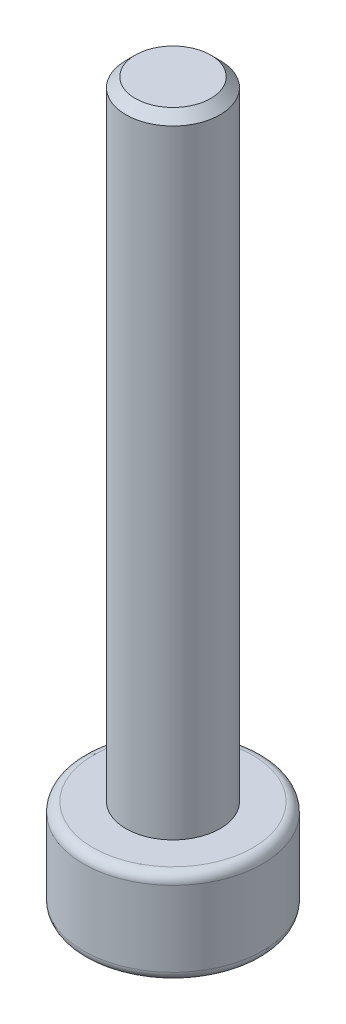
from build123d import *

# Parameters (mm, degrees)
SKETCH_1_R          = 2.85
EXTRUDE_1_DEPTH     = 3
SKETCH_2_R          = 1.5
EXTRUDE_2_DEPTH     = 20
SKETCH_3_R          = 1.29
CUT_EXTRUDE_1_DEPTH = 1.3
FILLET_1_R          = 0.3
CHAMFER_1_SIZE      = 0.3
CHAMFER_2_SIZE      = 0.15


with BuildPart() as part:
    # 草图1 → 凸台-拉伸1 (new body)
    with BuildSketch(Plane(origin=(0, 0, 0), x_dir=(1, 0, 0), z_dir=(0, 1, 0))):
        with Locations(Location((0, 0, 0), (0, 0, 270))):
            Circle(SKETCH_1_R)
    extrude(amount=EXTRUDE_1_DEPTH)

    # 草图2 → 凸台-拉伸2 (add)
    with BuildSketch(Plane(origin=(0, 3, 0), x_dir=(1, 0, 0), z_dir=(0, 1, 0))):
        with Locations(Location((0, 0, 0), (0, 0, 270))):
            Circle(SKETCH_2_R)
    extrude(amount=EXTRUDE_2_DEPTH)

    # 草图3 → 切除-拉伸1 (cut)
    with BuildSketch(Plane.XZ):
        with Locations(Location((0, 0, 0), (0, 0, 270))):
            Circle(SKETCH_3_R)
    extrude(amount=-CUT_EXTRUDE_1_DEPTH, mode=Mode.SUBTRACT)

    # 圆角1
    fillet_1_edges = [part.edges().sort_by_distance(p)[0] for p in [
        (0, 0, -2.85),
        (0, 3, -2.85),
    ]]
    fillet(fillet_1_edges, radius=FILLET_1_R)

    # 倒角1
    chamfer_1_edges = [part.edges().sort_by_distance(p)[0] for p in [
        (0, 23, -1.5),
    ]]
    chamfer(chamfer_1_edges, length=CHAMFER_1_SIZE)

    # 倒角2
    chamfer_2_edges = [part.edges().sort_by_distance(p)[0] for p in [
        (0, 0, 1.29),
    ]]
    chamfer(chamfer_2_edges, length=CHAMFER_2_SIZE)


solid = part.part
